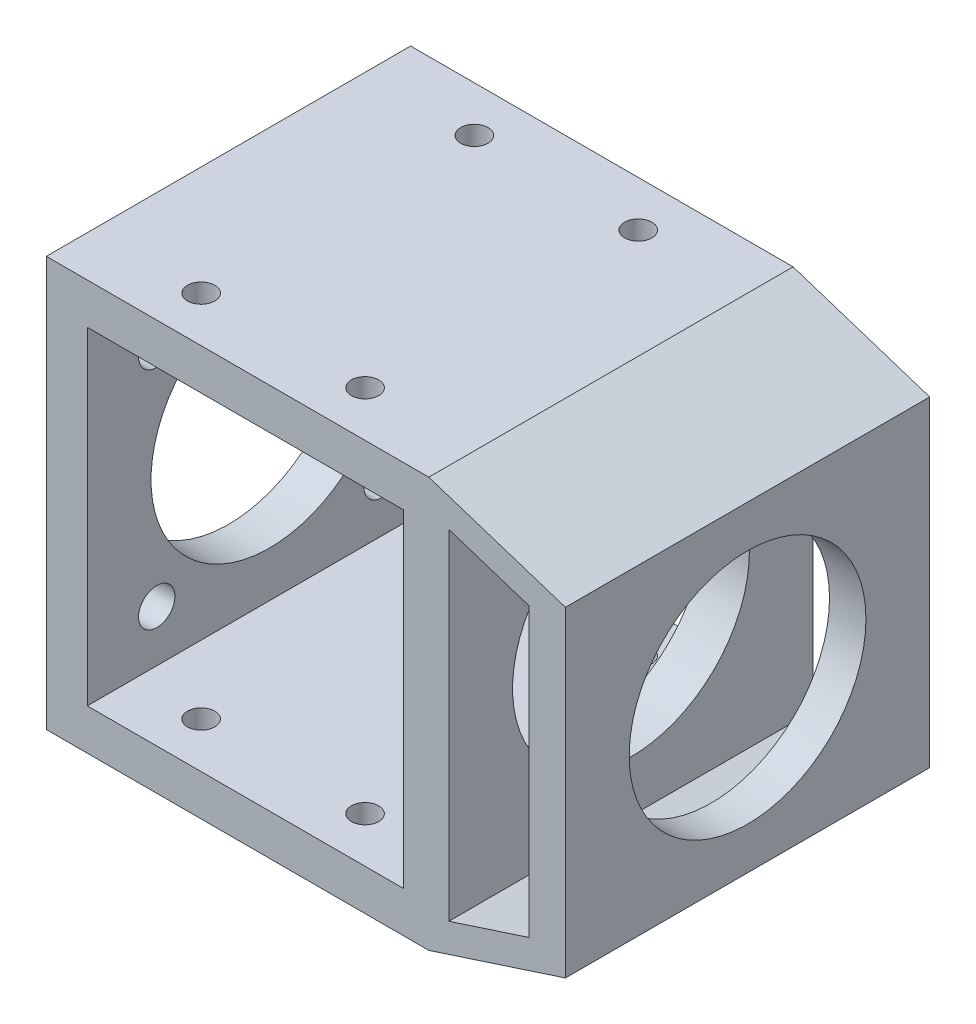
from build123d import *

# Parameters (mm, degrees)
SKETCH_1_W          = 57
SKETCH_1_H          = 40
EXTRUDE_1_DEPTH     = 45
SKETCH_5_R          = 13
CUT_EXTRUDE_1_DEPTH = 17.8
CUT_EXTRUDE_2_DEPTH = 36.2
SKETCH_7_R          = 13
CUT_EXTRUDE_3_DEPTH = 31.1
CUT_EXTRUDE_5_DEPTH = 83.909589313
SKETCH_12_R         = 2
CUT_EXTRUDE_6_DEPTH = 8
SKETCH_13_R         = 1.5
CUT_EXTRUDE_7_DEPTH = 76.325958341
CUT_EXTRUDE_9_DEPTH = 94
SKETCH_16_W         = 40
SKETCH_16_H         = 39
SKETCH_16_R         = 2
SKETCH_16_R_2       = 13
EXTRUDE_2_DEPTH     = 1.5
EXTRUDE_START       = 1.5
SKETCH_17_W         = 34.7
SKETCH_17_H         = 40
SKETCH_17_R         = 1.5
EXTRUDE_3_DEPTH     = 1.5
SKETCH_18_W         = 34.7
SKETCH_18_H         = 40
SKETCH_18_R         = 1.5
EXTRUDE_4_DEPTH     = 1.5
EXTRUDE_START_2     = 1
SKETCH_20_W         = 40
SKETCH_20_H         = 37.911419384
SKETCH_20_R         = 13
EXTRUDE_6_DEPTH     = 1


with BuildPart() as part:
    # 草图1 → 凸台-拉伸1 (new body)
    with BuildSketch(Plane(origin=(0, 0, 0), x_dir=(1, 0, 0), z_dir=(0, 1, 0))):
        with Locations((-28.5, 0)):
            Rectangle(SKETCH_1_W, SKETCH_1_H)
    extrude(amount=EXTRUDE_1_DEPTH)

    # 草图5 → 切除-拉伸1 (cut)
    with BuildSketch(Plane(origin=(0, 0, 0), x_dir=(0, 0, -1), z_dir=(1, 0, 0))):
        with Locations((0, 22.5)):
            Circle(SKETCH_5_R)
    extrude(amount=-CUT_EXTRUDE_1_DEPTH, mode=Mode.SUBTRACT)

    # 草图6 → 切除-拉伸2 (cut)
    with BuildSketch(Plane(origin=(-17.8, 0, 0), x_dir=(0, 0, -1), z_dir=(1, 0, 0))):
        Polygon((-22, 25), (-22, 3), (22, 3), (22, 25), (22, 42), (-22, 42), align=None)
    extrude(amount=-CUT_EXTRUDE_2_DEPTH, mode=Mode.SUBTRACT)

    # 草图7 → 切除-拉伸3 (cut)
    with BuildSketch(Plane(origin=(-54, 0, 0), x_dir=(0, 0, -1), z_dir=(1, 0, 0))):
        with Locations((0, 22.5)):
            Circle(SKETCH_7_R)
    extrude(amount=-CUT_EXTRUDE_3_DEPTH, mode=Mode.SUBTRACT)

    # 草图10 → 切除-拉伸5 (cut, through all)
    with BuildSketch(Plane.XY.offset(20)):
        Polygon((-15, 45), (0, 40.126204557), (0, 45), align=None)
        Polygon((0, 0), (-15, 0), (0, 4.873795443), align=None)
    extrude(amount=-CUT_EXTRUDE_5_DEPTH, mode=Mode.SUBTRACT)

    # 草图12 → 切除-拉伸6 (cut)
    with BuildSketch(Plane.ZY.offset(57)):
        with Locations((-12.374368671, 34.874368671)):
            Circle(SKETCH_12_R)
        with Locations((12.374368671, 34.874368671)):
            Circle(SKETCH_12_R)
        with Locations((12.374368671, 10.125631329)):
            Circle(SKETCH_12_R)
        with Locations((-12.374368671, 10.125631329)):
            Circle(SKETCH_12_R)
    extrude(amount=-CUT_EXTRUDE_6_DEPTH, mode=Mode.SUBTRACT)

    # 草图13 → 切除-拉伸7 (cut, through all)
    with BuildSketch(Plane(origin=(0, 45, 0), x_dir=(1, 0, 0), z_dir=(0, 1, 0))):
        with Locations(Location((-45, 15, 0), (0, 0, 270))):
            Circle(SKETCH_13_R)
        with Locations(Location((-27, 15, 0), (0, 0, 270))):
            Circle(SKETCH_13_R)
        with Locations(Location((-27, -15, 0), (0, 0, 270))):
            Circle(SKETCH_13_R)
        with Locations(Location((-45, -15, 0), (0, 0, 270))):
            Circle(SKETCH_13_R)
    extrude(amount=-CUT_EXTRUDE_7_DEPTH, mode=Mode.SUBTRACT)

    # 草图15 → 切除-拉伸9 (cut)
    with BuildSketch(Plane.XY.offset(20)):
        Polygon((-13.8, 41.455709692), (-4, 38.271496669), (-4, 6.728503331), (-13.8, 3.544290308), align=None)
    extrude(amount=-CUT_EXTRUDE_9_DEPTH, mode=Mode.SUBTRACT)

    # 草图16 → 凸台-拉伸2 (add)
    with BuildSketch(Plane(origin=(-54, 0, 0), x_dir=(0, 0, -1), z_dir=(1, 0, 0))):
        with Locations((0, 22.5)):
            Rectangle(SKETCH_16_W, SKETCH_16_H)
        with Locations(Location((-12.374368671, 10.125631329, 0), (0, 0, 180))):
            Circle(SKETCH_16_R, mode=Mode.SUBTRACT)
        with Locations(Location((12.374368671, 10.125631329, 0), (0, 0, 180))):
            Circle(SKETCH_16_R, mode=Mode.SUBTRACT)
        with Locations((0, 22.5)):
            Circle(SKETCH_16_R_2, mode=Mode.SUBTRACT)
        with Locations(Location((12.374368671, 34.874368671, 0), (0, 0, 180))):
            Circle(SKETCH_16_R, mode=Mode.SUBTRACT)
        with Locations(Location((-12.374368671, 34.874368671, 0), (0, 0, 180))):
            Circle(SKETCH_16_R, mode=Mode.SUBTRACT)
    extrude(amount=EXTRUDE_2_DEPTH)

    # 草图17 → 凸台-拉伸3 (add)
    with BuildSketch(Plane(origin=(0, 3, 0), x_dir=(1, 0, 0), z_dir=(0, 1, 0)).offset(EXTRUDE_START)):
        with Locations((-35.15, 0)):
            Rectangle(SKETCH_17_W, SKETCH_17_H)
        with Locations(Location((-45, -15, 0), (0, 0, 270))):
            Circle(SKETCH_17_R, mode=Mode.SUBTRACT)
        with Locations(Location((-27, -15, 0), (0, 0, 270))):
            Circle(SKETCH_17_R, mode=Mode.SUBTRACT)
        with Locations(Location((-27, 15, 0), (0, 0, 270))):
            Circle(SKETCH_17_R, mode=Mode.SUBTRACT)
        with Locations(Location((-45, 15, 0), (0, 0, 270))):
            Circle(SKETCH_17_R, mode=Mode.SUBTRACT)
    extrude(amount=-EXTRUDE_3_DEPTH)

    # 草图18 → 凸台-拉伸4 (add)
    with BuildSketch(Plane.XZ.offset(-42)):
        with Locations((-35.15, 0)):
            Rectangle(SKETCH_18_W, SKETCH_18_H)
        with Locations(Location((-45, -15, 0), (0, 0, 90))):
            Circle(SKETCH_18_R, mode=Mode.SUBTRACT)
        with Locations(Location((-27, -15, 0), (0, 0, 90))):
            Circle(SKETCH_18_R, mode=Mode.SUBTRACT)
        with Locations(Location((-27, 15, 0), (0, 0, 90))):
            Circle(SKETCH_18_R, mode=Mode.SUBTRACT)
        with Locations(Location((-45, 15, 0), (0, 0, 90))):
            Circle(SKETCH_18_R, mode=Mode.SUBTRACT)
    extrude(amount=EXTRUDE_4_DEPTH)

    # 草图20 → 凸台-拉伸6 (add)
    with BuildSketch(Plane(origin=(-13.8, 0, 0), x_dir=(0, 0, -1), z_dir=(1, 0, 0)).offset(EXTRUDE_START_2)):
        with Locations((0, 22.5)):
            Rectangle(SKETCH_20_W, SKETCH_20_H)
        with Locations((0, 22.5)):
            Circle(SKETCH_20_R, mode=Mode.SUBTRACT)
    extrude(amount=-EXTRUDE_6_DEPTH)


solid = part.part
